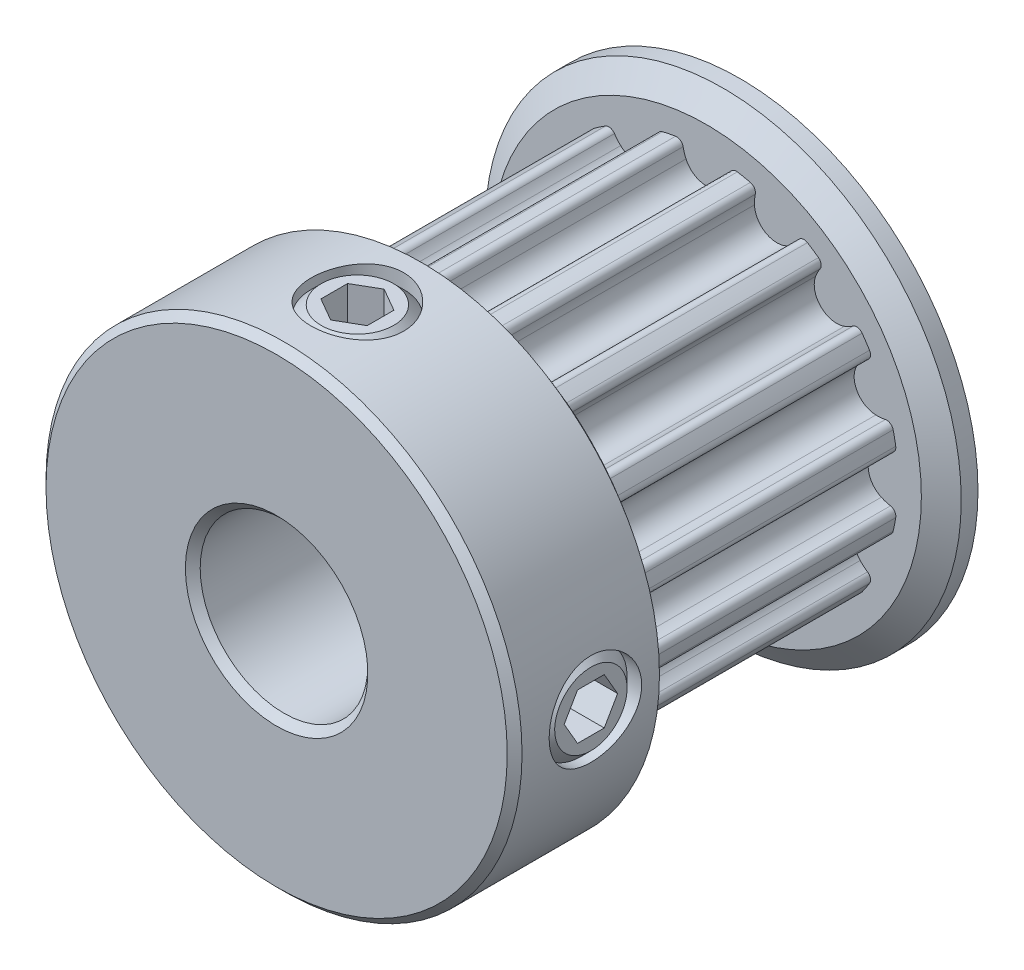
from build123d import *

# Parameters (mm, degrees)
CUT_EXTRUDE1_START = 2.655
CUT_EXTRUDE1_DEPTH = 10.16
CIRPATTERN1_COUNT  = 16
SKETCH4_R          = 1.7526
CUT_EXTRUDE2_DEPTH = 16.477114557
CUT_EXTRUDE3_DEPTH = 1.31445
CIRPATTERN3_COUNT  = 2
CIRPATTERN3_ANGLE  = 90
CHAMFER1_SIZE      = 0.28075


with BuildPart() as part:
    # Sketch2 → Revolve1 (revolve)
    with BuildSketch(Plane(origin=(0, 0, 0), x_dir=(0, 0, -1), z_dir=(1, 0, 0)), mode=Mode.PRIVATE) as revolve1_sk:
        Polygon((-8.775, 3.175), (8.775, 3.175), (8.775, 9.015), (8.14, 9.015), (7.505, 8.13975), (7.505, 7.2645), (-2.655, 7.2645), (-2.655, 8.13975), (-3.29, 9.015), (-8.775, 9.015), align=None)
    revolve(revolve1_sk.sketch.rotate(Axis((0, 0, 8.775), (0, 0, -1)), 90), axis=Axis((0, 0, 8.775), (0, 0, -1)))

    # Sketch3 → Cut-Extrude1 (cut)
    with BuildSketch(Plane.XY.offset(CUT_EXTRUDE1_START)):
        with BuildLine():
            Line((3.757926927, 9.015), (-3.757926927, 9.015))
            Line((-3.757926927, 9.015), (-2.795101196, 6.705249403))
            ThreePointArc((-2.795101196, 6.705249403), (-1.995846132, 6.984952288), (-1.169472895, 7.169748489))
            ThreePointArc((-1.169472895, 7.169748489), (-0.985767742, 7.127751824), (-0.883573242, 6.969424355))
            ThreePointArc((-0.883573242, 6.969424355), (-0.839120956, 6.792881518), (-0.773880597, 6.622919538))
            ThreePointArc((-0.773880597, 6.622919538), (0, 6.1245), (0.773880597, 6.622919538))
            ThreePointArc((0.773880597, 6.622919538), (0.839120956, 6.792881518), (0.883573242, 6.969424355))
            ThreePointArc((0.883573242, 6.969424355), (0.985767742, 7.127751824), (1.169472895, 7.169748489))
            ThreePointArc((1.169472895, 7.169748489), (1.995846132, 6.984952288), (2.795101196, 6.705249403))
            Line((2.795101196, 6.705249403), (3.757926927, 9.015))
        make_face()
    cut_extrude1 = extrude(amount=-CUT_EXTRUDE1_DEPTH, mode=Mode.SUBTRACT)

    # CirPattern1: Cut-Extrude1 ×16 about axis
    cirpattern1_axis = Axis((0, 0, 0), (0, 0, 1))
    for i in range(1, CIRPATTERN1_COUNT):
        add(cut_extrude1.rotate(cirpattern1_axis, i * 360 / CIRPATTERN1_COUNT), mode=Mode.SUBTRACT)

    # Sketch4 → Cut-Extrude2 (cut, through all)
    with BuildSketch(Plane(origin=(0, 0, 0), x_dir=(0, -1, 0), z_dir=(1, 0, 0))):
        with Locations(Location((0, -5.715, 0), (0, 0, 270))):
            Circle(SKETCH4_R)
    cut_extrude2 = extrude(amount=CUT_EXTRUDE2_DEPTH, mode=Mode.SUBTRACT)

    # Sketch5 → Revolve2 (revolve)
    with BuildSketch(Plane.XY.offset(5.715), mode=Mode.PRIVATE) as revolve2_sk:
        Polygon((3.175, -1.3716), (3.175, 0), (8.842998261, 0), (8.842998261, -1.3716), (8.461998261, -1.7526), (3.556, -1.7526), align=None)
    revolve2 = revolve(revolve2_sk.sketch.rotate(Axis((3.175, 0, 5.715), (1, 0, 0)), 270), axis=Axis((3.175, 0, 5.715), (1, 0, 0)))

    # Sketch6 → Cut-Extrude3 (cut)
    with BuildSketch(Plane(origin=(8.842998261, 5.384140679, 0), x_dir=(0, -1, 0), z_dir=(-1, 0, 0))):
        Polygon((5.384140679, 6.726864082), (4.507840679, 6.220932041), (4.507840679, 5.209067959), (5.384140679, 4.703135918), (6.260440679, 5.209067959), (6.260440679, 6.220932041), align=None)
    cut_extrude3 = extrude(amount=CUT_EXTRUDE3_DEPTH, mode=Mode.SUBTRACT)

    # CirPattern3: Cut-Extrude2, Revolve2, Cut-Extrude3 ×2 about axis
    cirpattern3_axis = Axis((0, 0, 0), (0, 0, 1))
    add([cut_extrude2.rotate(cirpattern3_axis, i * CIRPATTERN3_ANGLE / (CIRPATTERN3_COUNT - 1)) for i in range(1, CIRPATTERN3_COUNT)], mode=Mode.SUBTRACT)
    add([revolve2.rotate(cirpattern3_axis, i * CIRPATTERN3_ANGLE / (CIRPATTERN3_COUNT - 1)) for i in range(1, CIRPATTERN3_COUNT)])
    add([cut_extrude3.rotate(cirpattern3_axis, i * CIRPATTERN3_ANGLE / (CIRPATTERN3_COUNT - 1)) for i in range(1, CIRPATTERN3_COUNT)], mode=Mode.SUBTRACT)

    # Chamfer1
    chamfer1_edges = [part.edges().sort_by_distance(p)[0] for p in [
        (-3.175, 0, 8.775),
        (-9.015, 0, 8.775),
    ]]
    chamfer(chamfer1_edges, length=CHAMFER1_SIZE)


solid = part.part
